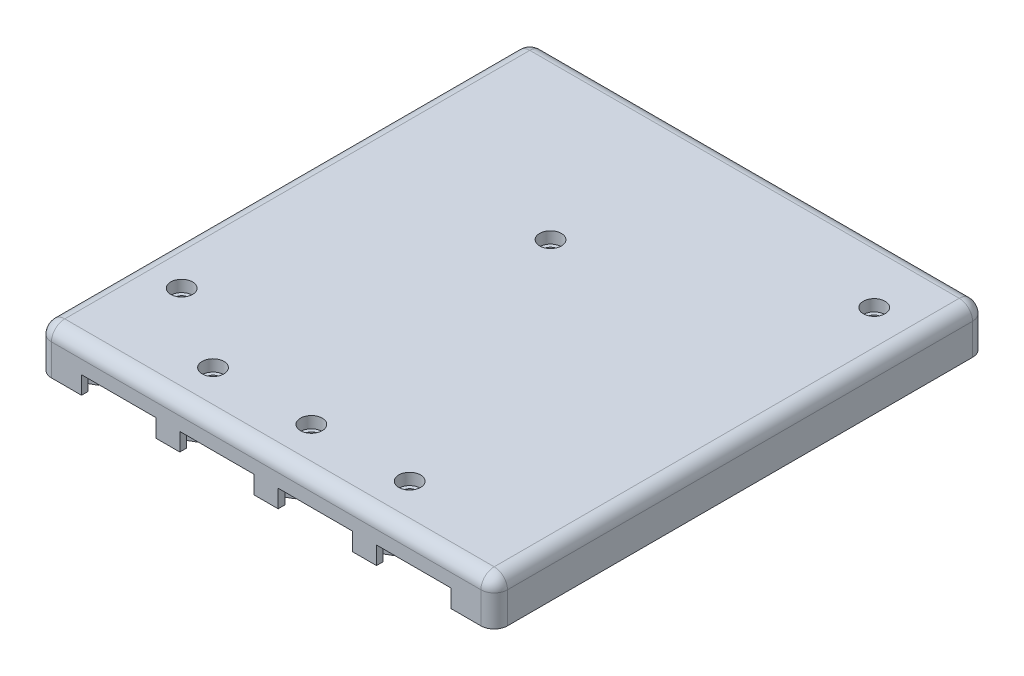
from build123d import *

# Parameters (mm, degrees)
SKETCH1_W           = 85.8
SKETCH1_H           = 92.5
SKETCH1_R           = 2.05
BOSS_EXTRUDE1_DEPTH = 3.175
SKETCH2_W           = 85.8
SKETCH2_H           = 92.5
SKETCH2_R           = 1.35
SKETCH2_R_2         = 3.35
BOSS_EXTRUDE2_DEPTH = 1.905
BOSS_EXTRUDE3_START = 1
SKETCH2_3_W         = 85.8
SKETCH2_3_H         = 92.5
SKETCH2_3_R         = 1.35
SKETCH2_3_R_2       = 3.35
BOSS_EXTRUDE3_DEPTH = 1
SKETCH3_W           = 85.8
SKETCH3_H           = 92.5
SKETCH3_W_2         = 75.8
SKETCH3_H_2         = 82.5
BOSS_EXTRUDE4_DEPTH = 3.3
SKETCH4_W           = 14
SKETCH4_H           = 6.75
CUT_EXTRUDE1_DEPTH  = 118.802300593
SKETCH5_W           = 10
SKETCH5_H           = 6
CUT_EXTRUDE2_DEPTH  = 118.802300593
BOSS_EXTRUDE5_DEPTH = 3.5
FILLET1_R           = 2.5
FILLET2_R           = 2.5
FILLET3_R           = 2.5
FILLET4_R           = 2.5
FILLET5_R           = 2.5
CUT_EXTRUDE3_DEPTH  = 3.36
CUT_EXTRUDE4_DEPTH  = 75
SKETCH10_W          = 4.501
SKETCH10_H          = 2
BOSS_EXTRUDE6_DEPTH = 5
SKETCH13_R          = 6.35
CUT_EXTRUDE5_DEPTH  = 2.5


with BuildPart() as part:
    # Sketch1 → Boss-Extrude1 (new body)
    with BuildSketch(Plane(origin=(0, 0, 0), x_dir=(1, 0, 0), z_dir=(0, 1, 0))):
        with Locations((36.9, 40.25)):
            Rectangle(SKETCH1_W, SKETCH1_H)
        with Locations((2.5, 12.5)):
            Circle(SKETCH1_R, mode=Mode.SUBTRACT)
        with Locations((18.4, 2.5)):
            Circle(SKETCH1_R, mode=Mode.SUBTRACT)
        with Locations((36.9, 2.5)):
            Circle(SKETCH1_R, mode=Mode.SUBTRACT)
        with Locations((55.4, 2.5)):
            Circle(SKETCH1_R, mode=Mode.SUBTRACT)
        with Locations((29.3, 55.1)):
            Circle(SKETCH1_R, mode=Mode.SUBTRACT)
        with Locations((70.8, 74.5)):
            Circle(SKETCH1_R, mode=Mode.SUBTRACT)
    extrude(amount=BOSS_EXTRUDE1_DEPTH)

    # Sketch2 → Boss-Extrude2 (add)
    # profile 1 of 2: a face of its own
    with BuildSketch(Plane(origin=(0, 0, 0), x_dir=(1, 0, 0), z_dir=(0, 1, 0))):
        with Locations((36.9, 40.25)):
            Rectangle(SKETCH2_W, SKETCH2_H)
        with Locations((2.5, 12.5)):
            Circle(SKETCH2_R, mode=Mode.SUBTRACT)
        with Locations((18.4, 2.5)):
            Circle(SKETCH2_R, mode=Mode.SUBTRACT)
        with Locations((36.9, 2.5)):
            Circle(SKETCH2_R, mode=Mode.SUBTRACT)
        with Locations((55.4, 2.5)):
            Circle(SKETCH2_R, mode=Mode.SUBTRACT)
        with BuildLine():
            Line((-1, 7.5), (2.5, 7.5))
            ThreePointArc((2.5, 7.5), (7.5, 12.5), (2.5, 17.5))
            Line((2.5, 17.5), (-1, 17.5))
            Line((-1, 17.5), (-1, 81.5))
            Line((-1, 81.5), (65.8, 81.5))
            Line((65.8, 81.5), (65.8, 74.5))
            ThreePointArc((65.8, 74.5), (67.264466094, 70.964466094), (70.8, 69.5))
            Line((70.8, 69.5), (74.8, 69.5))
            Line((74.8, 69.5), (74.8, -1))
            Line((74.8, -1), (60.4, -1))
            Line((60.4, -1), (60.4, 2.5))
            ThreePointArc((60.4, 2.5), (55.4, 7.5), (50.4, 2.5))
            Line((50.4, 2.5), (50.4, -1))
            Line((50.4, -1), (41.9, -1))
            Line((41.9, -1), (41.9, 2.5))
            ThreePointArc((41.9, 2.5), (36.9, 7.5), (31.9, 2.5))
            Line((31.9, 2.5), (31.9, -1))
            Line((31.9, -1), (23.4, -1))
            Line((23.4, -1), (23.4, 2.5))
            ThreePointArc((23.4, 2.5), (18.4, 7.5), (13.4, 2.5))
            Line((13.4, 2.5), (13.4, -1))
            Line((13.4, -1), (-1, -1))
            Line((-1, -1), (-1, 7.5))
        make_face(mode=Mode.SUBTRACT)
        with Locations((70.8, 74.5)):
            Circle(SKETCH2_R, mode=Mode.SUBTRACT)
    # profile 2 of 2: a face of its own
    with BuildSketch(Plane(origin=(0, 0, 0), x_dir=(1, 0, 0), z_dir=(0, 1, 0))):
        with Locations((29.3, 55.1)):
            Circle(SKETCH2_R_2)
        with Locations((29.3, 55.1)):
            Circle(SKETCH2_R, mode=Mode.SUBTRACT)
    extrude(amount=-BOSS_EXTRUDE2_DEPTH)

    # Sketch2<3> → Boss-Extrude3 (add)
    # profile 1 of 2: a face of its own
    with BuildSketch(Plane(origin=(0, 0, 0), x_dir=(1, 0, 0), z_dir=(0, 1, 0)).offset(BOSS_EXTRUDE3_START)):
        with Locations((36.9, 40.25)):
            Rectangle(SKETCH2_3_W, SKETCH2_3_H)
        with Locations((2.5, 12.5)):
            Circle(SKETCH2_3_R, mode=Mode.SUBTRACT)
        with Locations((18.4, 2.5)):
            Circle(SKETCH2_3_R, mode=Mode.SUBTRACT)
        with Locations((36.9, 2.5)):
            Circle(SKETCH2_3_R, mode=Mode.SUBTRACT)
        with Locations((55.4, 2.5)):
            Circle(SKETCH2_3_R, mode=Mode.SUBTRACT)
        with BuildLine():
            Line((-1, 7.5), (2.5, 7.5))
            ThreePointArc((2.5, 7.5), (7.5, 12.5), (2.5, 17.5))
            Line((2.5, 17.5), (-1, 17.5))
            Line((-1, 17.5), (-1, 81.5))
            Line((-1, 81.5), (65.8, 81.5))
            Line((65.8, 81.5), (65.8, 74.5))
            ThreePointArc((65.8, 74.5), (67.264466094, 70.964466094), (70.8, 69.5))
            Line((70.8, 69.5), (74.8, 69.5))
            Line((74.8, 69.5), (74.8, -1))
            Line((74.8, -1), (60.4, -1))
            Line((60.4, -1), (60.4, 2.5))
            ThreePointArc((60.4, 2.5), (55.4, 7.5), (50.4, 2.5))
            Line((50.4, 2.5), (50.4, -1))
            Line((50.4, -1), (41.9, -1))
            Line((41.9, -1), (41.9, 2.5))
            ThreePointArc((41.9, 2.5), (36.9, 7.5), (31.9, 2.5))
            Line((31.9, 2.5), (31.9, -1))
            Line((31.9, -1), (23.4, -1))
            Line((23.4, -1), (23.4, 2.5))
            ThreePointArc((23.4, 2.5), (18.4, 7.5), (13.4, 2.5))
            Line((13.4, 2.5), (13.4, -1))
            Line((13.4, -1), (-1, -1))
            Line((-1, -1), (-1, 7.5))
        make_face(mode=Mode.SUBTRACT)
        with Locations((70.8, 74.5)):
            Circle(SKETCH2_3_R, mode=Mode.SUBTRACT)
    # profile 2 of 2: a face of its own
    with BuildSketch(Plane(origin=(0, 0, 0), x_dir=(1, 0, 0), z_dir=(0, 1, 0)).offset(BOSS_EXTRUDE3_START)):
        with Locations((29.3, 55.1)):
            Circle(SKETCH2_3_R_2)
        with Locations((29.3, 55.1)):
            Circle(SKETCH2_3_R, mode=Mode.SUBTRACT)
    extrude(amount=-BOSS_EXTRUDE3_DEPTH)

    # Sketch3 → Boss-Extrude4 (add)
    with BuildSketch(Plane(origin=(0, -1.905, 0), x_dir=(-1, 0, 0), z_dir=(0, -1, 0))):
        with Locations((-36.9, 40.25)):
            Rectangle(SKETCH3_W, SKETCH3_H)
        with Locations((-36.9, 40.25)):
            Rectangle(SKETCH3_W_2, SKETCH3_H_2, mode=Mode.SUBTRACT)
    extrude(amount=BOSS_EXTRUDE4_DEPTH)

    # Sketch4 → Cut-Extrude1 (cut, through all)
    with BuildSketch(Plane.XY):
        with Locations((9.15, -5.22)):
            Rectangle(SKETCH4_W, SKETCH4_H)
        with Locations((27.65, -5.22)):
            Rectangle(SKETCH4_W, SKETCH4_H)
        with Locations((46.15, -5.22)):
            Rectangle(SKETCH4_W, SKETCH4_H)
        with Locations((64.65, -5.22)):
            Rectangle(SKETCH4_W, SKETCH4_H)
    extrude(amount=CUT_EXTRUDE1_DEPTH, mode=Mode.SUBTRACT)

    # Sketch5 → Cut-Extrude2 (cut, through all)
    with BuildSketch(Plane.XY):
        with Locations((58, -6.205)):
            Rectangle(SKETCH5_W, SKETCH5_H)
    extrude(amount=-CUT_EXTRUDE2_DEPTH, mode=Mode.SUBTRACT)

    # Sketch6 → Boss-Extrude5 (add)
    with BuildSketch(Plane.ZY.offset(6)):
        with BuildLine():
            Line((-59.6, 0), (-59.6, -8.5))
            Line((-59.6, -8.5), (-59.131128874, -8.5))
            ThreePointArc((-59.131128874, -8.5), (-55.1, -6), (-51.068871126, -8.5))
            Line((-51.068871126, -8.5), (-50.6, -8.5))
            Line((-50.6, -8.5), (-50.6, 0))
            Line((-50.6, 0), (-59.6, 0))
        make_face()
    extrude(amount=-BOSS_EXTRUDE5_DEPTH)

    # Fillet1
    fillet1_edges = [part.edges().sort_by_distance(p)[0] for p in [
        (79.8, -1.015, 6),
    ]]
    fillet(fillet1_edges, radius=FILLET1_R)

    # Fillet2
    fillet2_edges = [part.edges().sort_by_distance(p)[0] for p in [
        (79.8, -1.015, -86.5),
    ]]
    fillet(fillet2_edges, radius=FILLET2_R)

    # Fillet3
    fillet3_edges = [part.edges().sort_by_distance(p)[0] for p in [
        (-6, -1.015, -86.5),
    ]]
    fillet(fillet3_edges, radius=FILLET3_R)

    # Fillet4
    fillet4_edges = [part.edges().sort_by_distance(p)[0] for p in [
        (-6, -1.015, 6),
    ]]
    fillet(fillet4_edges, radius=FILLET4_R)

    # Fillet5
    fillet5_edges = [part.edges().sort_by_distance(p)[0] for p in [
        (79.067766953, 3.175, -85.767766953),
        (79.8, 3.175, -40.25),
        (79.067766953, 3.175, 5.267766953),
        (36.9, 3.175, 6),
        (-5.267766953, 3.175, 5.267766953),
        (-6, 3.175, -40.25),
        (-5.267766953, 3.175, -85.767766953),
        (36.9, 3.175, -86.5),
    ]]
    fillet(fillet5_edges, radius=FILLET5_R)

    # Sketch7 → Cut-Extrude3 (cut)
    with BuildSketch(Plane(origin=(0, -5.205, 0), x_dir=(-1, 0, 0), z_dir=(0, -1, 0))):
        Polygon((-2.15, -2.75), (-0.4, -3.75), (-2.15, -4.75), align=None)
        Polygon((-16.15, -2.75), (-17.9, -3.75), (-16.15, -4.75), align=None)
        Polygon((-20.65, -2.75), (-18.9, -3.75), (-20.65, -4.75), align=None)
        Polygon((-34.65, -2.75), (-36.4, -3.75), (-34.65, -4.75), align=None)
        Polygon((-39.15, -2.75), (-39.15, -4.75), (-37.4, -3.75), align=None)
        Polygon((-53.15, -2.75), (-53.15, -4.75), (-54.9, -3.75), align=None)
        Polygon((-57.65, -4.75), (-55.9, -3.75), (-57.65, -2.75), align=None)
        Polygon((-71.65, -2.75), (-73.4, -3.75), (-71.65, -4.75), align=None)
    extrude(amount=-CUT_EXTRUDE3_DEPTH, mode=Mode.SUBTRACT)

    # Sketch8 → Cut-Extrude4 (cut)
    with BuildSketch(Plane(origin=(0, 0, 0), x_dir=(0, 0, -1), z_dir=(1, 0, 0))):
        Polygon((-4.75, -1.9), (-2.75, -1.9), (-3.75, -0.15), align=None)
    extrude(amount=CUT_EXTRUDE4_DEPTH, mode=Mode.SUBTRACT)

    # Sketch10 → Boss-Extrude6 (add)
    with BuildSketch(Plane.XY.offset(6)):
        with Locations((-0.1005, -0.845)):
            Rectangle(SKETCH10_W, SKETCH10_H)
        with Locations((18.3995, -0.845)):
            Rectangle(SKETCH10_W, SKETCH10_H)
        with Locations((36.8995, -0.845)):
            Rectangle(SKETCH10_W, SKETCH10_H)
        with Locations((55.3995, -0.845)):
            Rectangle(SKETCH10_W, SKETCH10_H)
        with Locations((73.9005, -0.845)):
            Rectangle(SKETCH10_W, SKETCH10_H)
    extrude(amount=-BOSS_EXTRUDE6_DEPTH)

    # Sketch13 → Cut-Extrude5 (cut)
    with BuildSketch(Plane(origin=(0, 0, 0), x_dir=(0, 0, -1), z_dir=(1, 0, 0))):
        with Locations((55.1, -10.95)):
            Circle(SKETCH13_R)
    extrude(amount=-CUT_EXTRUDE5_DEPTH, mode=Mode.SUBTRACT)


solid = part.part
